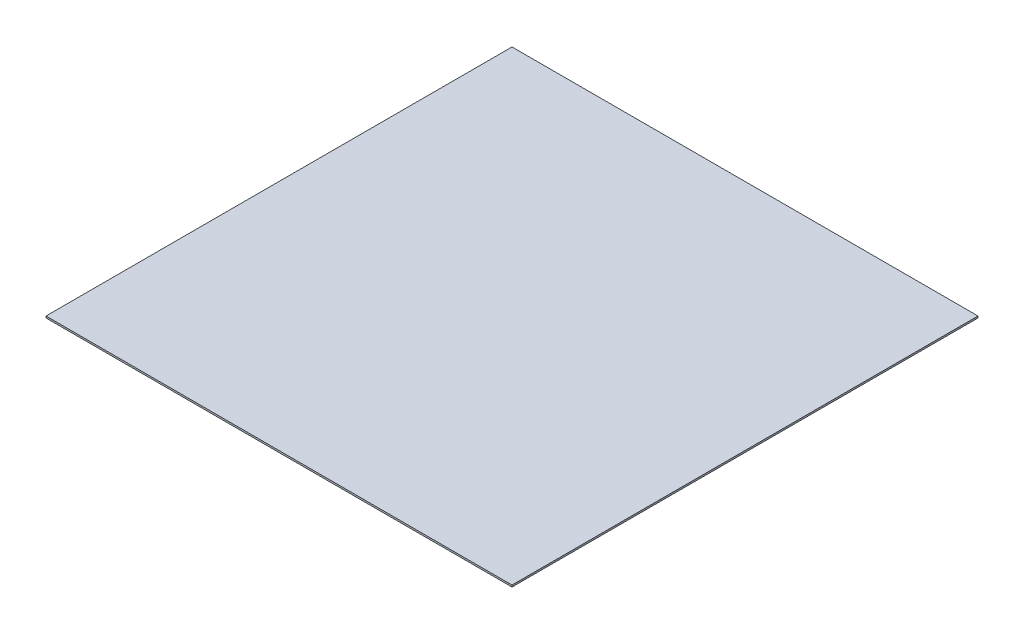
from build123d import *

# Parameters (mm, degrees)
SKETCH2_W           = 800
SKETCH2_H           = 800
BOSS_EXTRUDE1_DEPTH = 3


with BuildPart() as part:
    # Sketch2 → Boss-Extrude1 (new body)
    with BuildSketch(Plane(origin=(0, 0, 0), x_dir=(1, 0, 0), z_dir=(0, 1, 0))):
        Rectangle(SKETCH2_W, SKETCH2_H)
    extrude(amount=BOSS_EXTRUDE1_DEPTH)


solid = part.part
